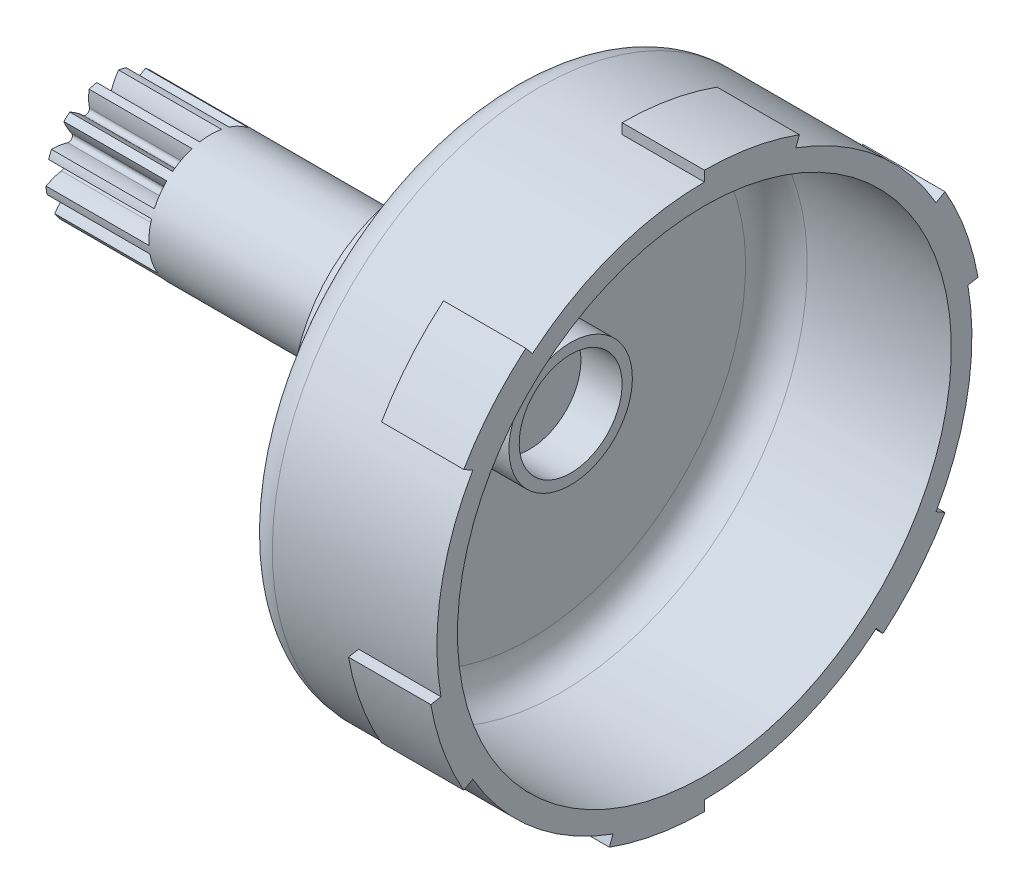
from build123d import *

# Parameters (mm, degrees)
SKETCH2_R           = 6
SKETCH2_R_2         = 5
BOSS_EXTRUDE1_DEPTH = 4
SKETCH3_R           = 12
BOSS_EXTRUDE2_DEPTH = 9
BOSS_EXTRUDE3_START = 30
SKETCH4_R           = 6
BOSS_EXTRUDE3_DEPTH = 30
BOSS_EXTRUDE4_START = -8
BOSS_EXTRUDE4_DEPTH = 8
CUT_EXTRUDE2_DEPTH  = 10


with BuildPart() as part:
    # Sketch1 → Revolve1 (revolve)
    with BuildSketch(Plane.XY):
        with BuildLine():
            Line((-19, 0), (-17, 0))
            Line((-17, 0), (-17, 21))
            ThreePointArc((-17, 21), (-16.121320344, 23.121320344), (-14, 24))
            Line((-14, 24), (0, 24))
            Line((0, 24), (0, 26))
            Line((0, 26), (-16, 26))
            ThreePointArc((-16, 26), (-18.121320344, 25.121320344), (-19, 23))
            Line((-19, 23), (-19, 0))
        make_face()
    revolve(axis=Axis((0, 0, 0), (-1, 0, 0)))

    # Sketch2 → Boss-Extrude1 (add)
    with BuildSketch(Plane(origin=(-17, 0, 0), x_dir=(0, 0, -1), z_dir=(1, 0, 0))):
        with Locations(Location((0, 0, 0), (0, 0, 90))):
            Circle(SKETCH2_R)
        with Locations(Location((0, 0, 0), (0, 0, 90))):
            Circle(SKETCH2_R_2, mode=Mode.SUBTRACT)
    extrude(amount=BOSS_EXTRUDE1_DEPTH)

    # Sketch3 → Boss-Extrude2 (add)
    with BuildSketch(Plane.ZY.offset(19)):
        with Locations(Location((0, 0, 0), (0, 0, 270))):
            Circle(SKETCH3_R)
    extrude(amount=BOSS_EXTRUDE2_DEPTH)

    # Sketch4 → Boss-Extrude3 (add)
    with BuildSketch(Plane.ZY.offset(28).offset(BOSS_EXTRUDE3_START)):
        with Locations(Location((0, 0, 0), (0, 0, 90))):
            Circle(SKETCH4_R)
    extrude(amount=-BOSS_EXTRUDE3_DEPTH)

    # Sketch5 → Boss-Extrude4 (add)
    with BuildSketch(Plane(origin=(0, 0, 0), x_dir=(0, 0, -1), z_dir=(1, 0, 0)).offset(BOSS_EXTRUDE4_START)):
        with BuildLine():
            Line((0, 26), (0, 27))
            ThreePointArc((0, 27), (4.688500797, 26.589809331), (9.23454387, 25.371700761))
            Line((9.23454387, 25.371700761), (8.892523726, 24.43200814))
            ThreePointArc((8.892523726, 24.43200814), (4.514852619, 25.605001578), (0, 26))
        make_face()
        with BuildLine():
            Line((22.516660498, 13), (23.382685902, 13.5))
            ThreePointArc((23.382685902, 13.5), (25.371700761, 9.23454387), (26.589809331, 4.688500797))
            Line((26.589809331, 4.688500797), (25.605001578, 4.514852619))
            ThreePointArc((25.605001578, 4.514852619), (24.43200814, 8.892523726), (22.516660498, 13))
        make_face()
        with BuildLine():
            Line((22.516660498, -13), (23.382685902, -13.5))
            ThreePointArc((23.382685902, -13.5), (20.683199964, -17.355265462), (17.355265462, -20.683199964))
            Line((17.355265462, -20.683199964), (16.712477852, -19.917155521))
            ThreePointArc((16.712477852, -19.917155521), (19.917155521, -16.712477852), (22.516660498, -13))
        make_face()
        with BuildLine():
            Line((0, -26), (0, -27))
            ThreePointArc((0, -27), (-4.688500797, -26.589809331), (-9.23454387, -25.371700761))
            Line((-9.23454387, -25.371700761), (-8.892523726, -24.43200814))
            ThreePointArc((-8.892523726, -24.43200814), (-4.514852619, -25.605001578), (0, -26))
        make_face()
        with BuildLine():
            Line((-22.516660498, -13), (-23.382685902, -13.5))
            ThreePointArc((-23.382685902, -13.5), (-25.371700761, -9.23454387), (-26.589809331, -4.688500797))
            Line((-26.589809331, -4.688500797), (-25.605001578, -4.514852619))
            ThreePointArc((-25.605001578, -4.514852619), (-24.43200814, -8.892523726), (-22.516660498, -13))
        make_face()
        with BuildLine():
            Line((-22.516660498, 13), (-23.382685902, 13.5))
            ThreePointArc((-23.382685902, 13.5), (-20.683199964, 17.355265462), (-17.355265462, 20.683199964))
            Line((-17.355265462, 20.683199964), (-16.712477852, 19.917155521))
            ThreePointArc((-16.712477852, 19.917155521), (-19.917155521, 16.712477852), (-22.516660498, 13))
        make_face()
    extrude(amount=BOSS_EXTRUDE4_DEPTH)

    # Sketch6 → Cut-Extrude2 (cut)
    with BuildSketch(Plane.ZY.offset(58)):
        with BuildLine():
            ThreePointArc((-1.775009671, 4.135134903), (-1.847979553, 4.927336232), (-1.805897134, 5.721777306))
            ThreePointArc((-1.805897134, 5.721777306), (-2.788339032, 5.312736154), (-3.683063909, 4.736564181))
            ThreePointArc((-3.683063909, 4.736564181), (-3.005346184, 4.319903366), (-2.394828889, 3.809828683))
            ThreePointArc((-2.394828889, 3.809828683), (-1.967355774, 3.748483247), (-1.775009671, 4.135134903))
        make_face()
        with BuildLine():
            ThreePointArc((-3.493386018, 2.836591992), (-3.926151954, 3.504140637), (-4.258084999, 4.227139948))
            ThreePointArc((-4.258084999, 4.227139948), (-4.937903195, 3.40838848), (-5.462382262, 2.482414153))
            ThreePointArc((-5.462382262, 2.482414153), (-4.668661083, 2.428430454), (-3.891031341, 2.260503286))
            ThreePointArc((-3.891031341, 2.260503286), (-3.484014049, 2.404841262), (-3.493386018, 2.836591992))
        make_face()
        with BuildLine():
            ThreePointArc((-4.411469728, 0.88822004), (-5.104890258, 1.278188652), (-5.734796905, 1.764115771))
            ThreePointArc((-5.734796905, 1.764115771), (-5.956253245, 0.723220082), (-5.990334668, -0.340427042))
            ThreePointArc((-5.990334668, -0.340427042), (-5.262441991, -0.019366609), (-4.495845404, 0.193323828))
            ThreePointArc((-4.495845404, 0.193323828), (-4.202526693, 0.510279126), (-4.411469728, 0.88822004))
        make_face()
        with BuildLine():
            ThreePointArc((-4.318938887, -1.263632419), (-5.114159724, -1.24058095), (-5.897735953, -1.103046069))
            ThreePointArc((-5.897735953, -1.103046069), (-5.610097456, -2.127629322), (-5.145973592, -3.085280504))
            ThreePointArc((-5.145973592, -3.085280504), (-4.650660859, -2.462727016), (-4.070715466, -1.918143789))
            ThreePointArc((-4.070715466, -1.918143789), (-3.958291117, -1.501181809), (-4.318938887, -1.263632419))
        make_face()
        with BuildLine():
            ThreePointArc((-3.236991196, -3.126001919), (-3.95183683, -3.475148407), (-4.709574769, -3.717513349))
            ThreePointArc((-4.709574769, -3.717513349), (-3.978735949, -4.491064489), (-3.122731983, -5.123333384))
            ThreePointArc((-3.122731983, -5.123333384), (-2.97346937, -4.341906342), (-2.713033672, -3.59018778))
            ThreePointArc((-2.713033672, -3.59018778), (-2.807258749, -3.168740082), (-3.236991196, -3.126001919))
        make_face()
        with BuildLine():
            ThreePointArc((-1.413487832, -4.272242052), (-1.884195742, -4.913601244), (-2.442506762, -5.480343121))
            ThreePointArc((-2.442506762, -5.480343121), (-1.435893986, -5.825650905), (-0.384110109, -5.987692329))
            ThreePointArc((-0.384110109, -5.987692329), (-0.615091883, -5.226407251), (-0.73382856, -4.439763017))
            ThreePointArc((-0.73382856, -4.439763017), (-1.013117233, -4.11037819), (-1.413487832, -4.272242052))
        make_face()
        with BuildLine():
            ThreePointArc((0.384110109, -5.987692329), (1.435893986, -5.825650905), (2.442506762, -5.480343121))
            ThreePointArc((2.442506762, -5.480343121), (1.884195742, -4.913601244), (1.413487832, -4.272242052))
            ThreePointArc((1.413487832, -4.272242052), (1.013117233, -4.11037819), (0.73382856, -4.439763017))
            ThreePointArc((0.73382856, -4.439763017), (0.615091883, -5.226407251), (0.384110109, -5.987692329))
        make_face()
        with BuildLine():
            ThreePointArc((3.122731983, -5.123333384), (3.978735949, -4.491064489), (4.709574769, -3.717513349))
            ThreePointArc((4.709574769, -3.717513349), (3.95183683, -3.475148407), (3.236991196, -3.126001919))
            ThreePointArc((3.236991196, -3.126001919), (2.807258749, -3.168740082), (2.713033672, -3.59018778))
            ThreePointArc((2.713033672, -3.59018778), (2.97346937, -4.341906342), (3.122731983, -5.123333384))
        make_face()
        with BuildLine():
            ThreePointArc((5.145973592, -3.085280504), (5.610097456, -2.127629322), (5.897735953, -1.103046069))
            ThreePointArc((5.897735953, -1.103046069), (5.114159724, -1.24058095), (4.318938887, -1.263632419))
            ThreePointArc((4.318938887, -1.263632419), (3.958291117, -1.501181809), (4.070715466, -1.918143789))
            ThreePointArc((4.070715466, -1.918143789), (4.650660859, -2.462727016), (5.145973592, -3.085280504))
        make_face()
        with BuildLine():
            ThreePointArc((6, 0), (5.933328806, 0.891969329), (5.734796905, 1.764115771))
            ThreePointArc((5.734796905, 1.764115771), (5.104890258, 1.278188652), (4.411469728, 0.88822004))
            ThreePointArc((4.411469728, 0.88822004), (4.202526693, 0.510279126), (4.495845404, 0.193323828))
            ThreePointArc((4.495845404, 0.193323828), (5.262441991, -0.019366609), (5.990334668, -0.340427042))
            ThreePointArc((5.990334668, -0.340427042), (5.99758318, -0.170282111), (6, 0))
        make_face()
        with BuildLine():
            ThreePointArc((5.462382262, 2.482414153), (4.937903195, 3.40838848), (4.258084999, 4.227139948))
            ThreePointArc((4.258084999, 4.227139948), (3.926151954, 3.504140637), (3.493386018, 2.836591992))
            ThreePointArc((3.493386018, 2.836591992), (3.484014049, 2.404841262), (3.891031341, 2.260503286))
            ThreePointArc((3.891031341, 2.260503286), (4.668661083, 2.428430454), (5.462382262, 2.482414153))
        make_face()
        with BuildLine():
            ThreePointArc((3.683063909, 4.736564181), (2.788339032, 5.312736154), (1.805897134, 5.721777306))
            ThreePointArc((1.805897134, 5.721777306), (1.847979553, 4.927336232), (1.775009671, 4.135134903))
            ThreePointArc((1.775009671, 4.135134903), (1.967355774, 3.748483247), (2.394828889, 3.809828683))
            ThreePointArc((2.394828889, 3.809828683), (3.005346184, 4.319903366), (3.683063909, 4.736564181))
        make_face()
        with BuildLine():
            ThreePointArc((1.06, 5.905624438), (0, 6), (-1.06, 5.905624438))
            ThreePointArc((-1.06, 5.905624438), (-0.653542693, 5.221738477), (-0.35, 4.486368242))
            ThreePointArc((-0.35, 4.486368242), (0, 4.233392894), (0.35, 4.486368242))
            ThreePointArc((0.35, 4.486368242), (0.653542693, 5.221738477), (1.06, 5.905624438))
        make_face()
    extrude(amount=-CUT_EXTRUDE2_DEPTH, mode=Mode.SUBTRACT)


solid = part.part
